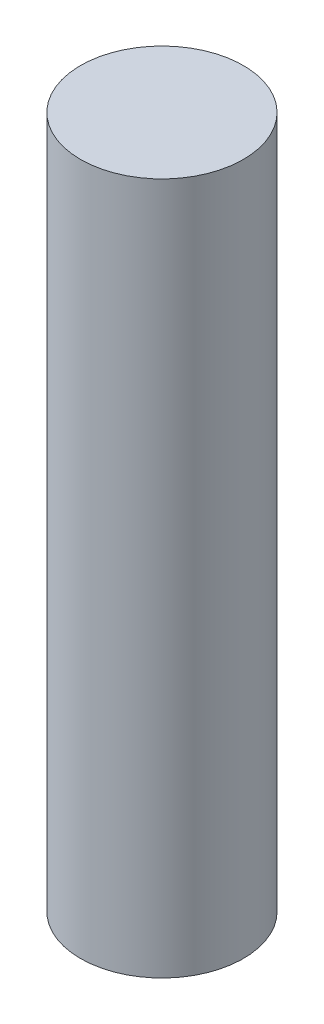
from build123d import *

# Parameters (mm, degrees)
SKETCH1_R           = 10
BOSS_EXTRUDE1_DEPTH = 85


with BuildPart() as part:
    # Sketch1 → Boss-Extrude1 (new body)
    with BuildSketch(Plane(origin=(0, 0, 0), x_dir=(1, 0, 0), z_dir=(0, 1, 0))):
        with Locations(Location((0, 0, 0), (0, 0, 270))):
            Circle(SKETCH1_R)
    extrude(amount=BOSS_EXTRUDE1_DEPTH)


solid = part.part
